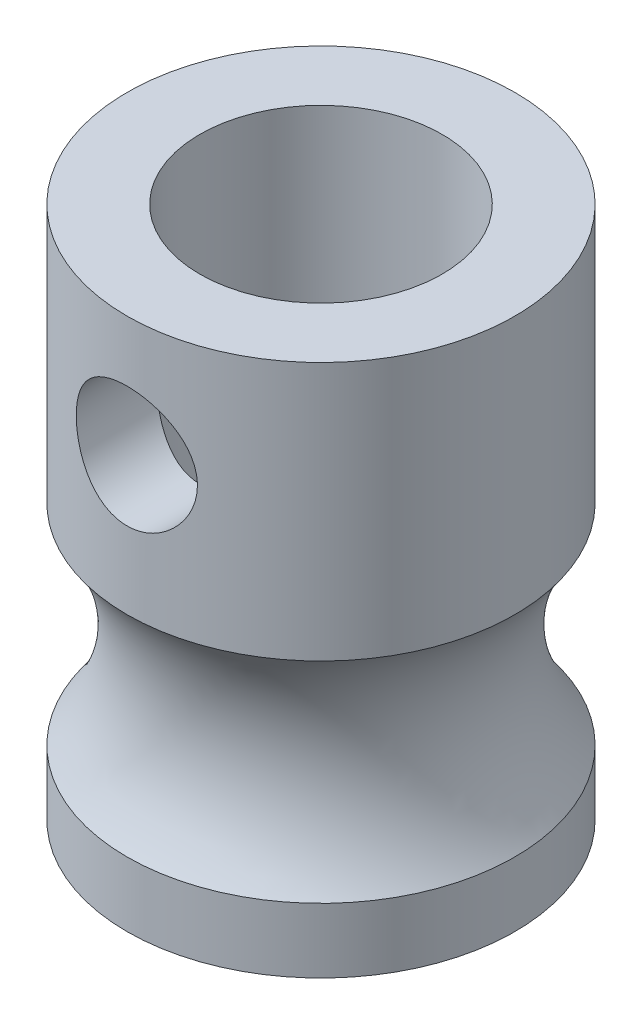
from build123d import *

# Parameters (mm, degrees)
SKETCH1_R              = 4
SKETCH1_R_2            = 2.5
BOSS_EXTRUDE1_DEPTH    = 11
M3_TAPPED_HOLE1_REACH  = 16.177
M3_TAPPED_HOLE1_BORE_R = 1.25
SKETCH8_R              = 3.5


with BuildPart() as part:
    # Sketch1 → Boss-Extrude1 (new body)
    with BuildSketch(Plane(origin=(0, 0, 0), x_dir=(1, 0, 0), z_dir=(0, 1, 0))):
        with Locations(Location((0, 0, 0), (0, 0, 270))):
            Circle(SKETCH1_R)
        with Locations(Location((0, 0, 0), (0, 0, 270))):
            Circle(SKETCH1_R_2, mode=Mode.SUBTRACT)
    extrude(amount=BOSS_EXTRUDE1_DEPTH)

    # M3 Tapped Hole1 bore → M3 Tapped Hole1 (cut, up to next)
    with BuildSketch(Plane.XY.offset(4), mode=Mode.PRIVATE) as m3_tapped_hole1_sk1:
        with Locations((0, 8.5)):
            Circle(M3_TAPPED_HOLE1_BORE_R)
    m3_tapped_hole1_tool1 = extrude(m3_tapped_hole1_sk1.sketch, amount=-M3_TAPPED_HOLE1_REACH, mode=Mode.PRIVATE) & part.part
    add(m3_tapped_hole1_tool1.solids().sort_by_distance((0, 8.5, 4))[0], mode=Mode.SUBTRACT)

    # Sketch8 → Cut-Revolve2 (revolve, cut)
    with BuildSketch(Plane.XY, mode=Mode.PRIVATE) as cut_revolve2_sk:
        with Locations((6.75, 3.5)):
            Circle(SKETCH8_R)
    revolve(cut_revolve2_sk.sketch.rotate(Axis((0, 11, 0), (0, -1, 0)), 90), axis=Axis((0, 11, 0), (0, -1, 0)), mode=Mode.SUBTRACT)


solid = part.part
